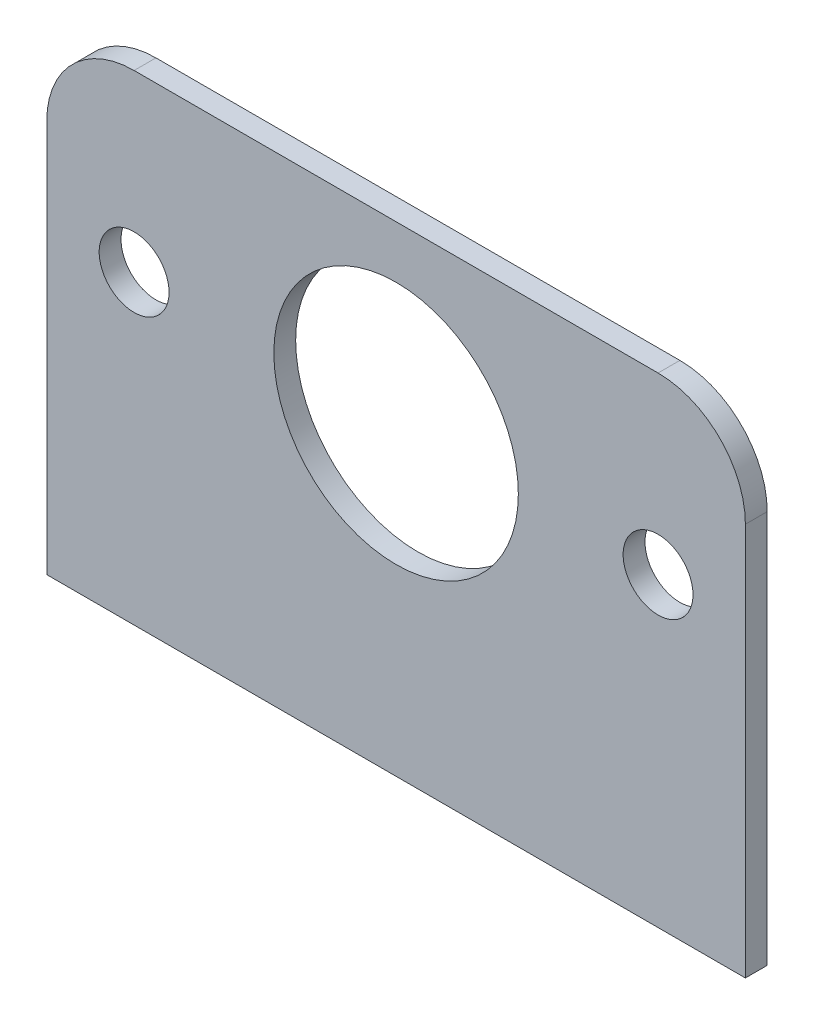
from build123d import *

# Parameters (mm, degrees)
SKETCH1_W           = 50.8
SKETCH1_H           = 25.4
SKETCH1_R           = 8.89
SKETCH1_R_2         = 2.54
BOSS_EXTRUDE1_DEPTH = 1.5875
SKETCH3_W           = 50.8
SKETCH3_H           = 9.525
BOSS_EXTRUDE2_DEPTH = 1.5875
FILLET1_R           = 6.35


with BuildPart() as part:
    # Sketch1 → Boss-Extrude1 (new body)
    with BuildSketch(Plane.XY):
        Rectangle(SKETCH1_W, SKETCH1_H)
        Circle(SKETCH1_R, mode=Mode.SUBTRACT)
        with Locations((19.05, 0)):
            Circle(SKETCH1_R_2, mode=Mode.SUBTRACT)
        with Locations((-19.05, 0)):
            Circle(SKETCH1_R_2, mode=Mode.SUBTRACT)
    extrude(amount=BOSS_EXTRUDE1_DEPTH)

    # Sketch3 → Boss-Extrude2 (add)
    with BuildSketch(Plane.XY):
        with Locations((0, -17.4625)):
            Rectangle(SKETCH3_W, SKETCH3_H)
    extrude(amount=BOSS_EXTRUDE2_DEPTH)

    # Fillet1
    fillet1_edges = [part.edges().sort_by_distance(p)[0] for p in [
        (-25.4, 12.7, 0.79375),
        (25.4, 12.7, 0.79375),
    ]]
    fillet(fillet1_edges, radius=FILLET1_R)


solid = part.part
